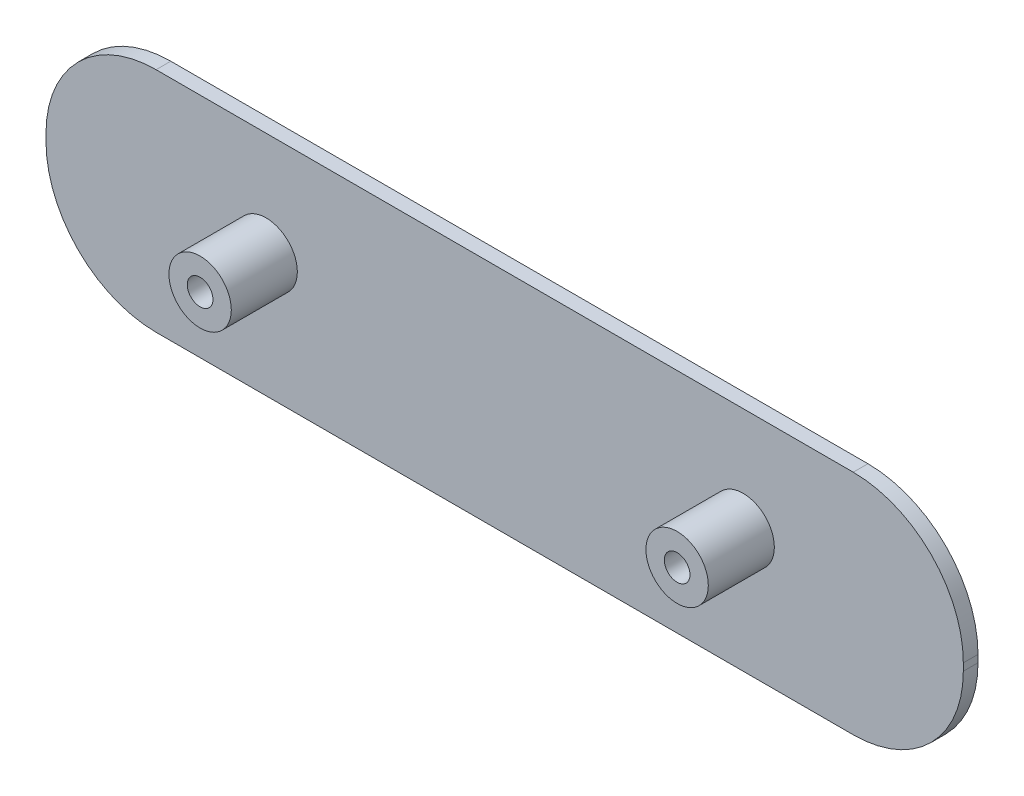
from build123d import *

# Parameters (mm, degrees)
ESQUISSE1_W        = 125
ESQUISSE1_H        = 30.99
BOSS_EXTRU_1_DEPTH = 2
CONG_1_R           = 15
ESQUISSE2_R        = 4.25
ESQUISSE2_R_2      = 1.75
BOSS_EXTRU_2_DEPTH = 9


with BuildPart() as part:
    # Esquisse1 → Boss.-Extru.1 (new body)
    with BuildSketch(Plane.XY):
        with Locations((-62.5, 15.495)):
            Rectangle(ESQUISSE1_W, ESQUISSE1_H)
    extrude(amount=BOSS_EXTRU_1_DEPTH)

    # Congé1
    cong_1_edges = [part.edges().sort_by_distance(p)[0] for p in [
        (0, 0, 1),
        (-125, 0, 1),
        (-125, 30.99, 1),
        (0, 30.99, 1),
    ]]
    fillet(cong_1_edges, radius=CONG_1_R)

    # Esquisse2 → Boss.-Extru.2 (add)
    # profile 1 of 2: a face of its own
    with BuildSketch(Plane.XY.offset(2)):
        with Locations((-95, 16.75)):
            Circle(ESQUISSE2_R)
        with Locations((-95, 16.75)):
            Circle(ESQUISSE2_R_2, mode=Mode.SUBTRACT)
    # profile 2 of 2: a face of its own
    with BuildSketch(Plane.XY.offset(2)):
        with Locations((-30, 16.75)):
            Circle(ESQUISSE2_R)
        with Locations((-30, 16.75)):
            Circle(ESQUISSE2_R_2, mode=Mode.SUBTRACT)
    extrude(amount=BOSS_EXTRU_2_DEPTH)


solid = part.part
